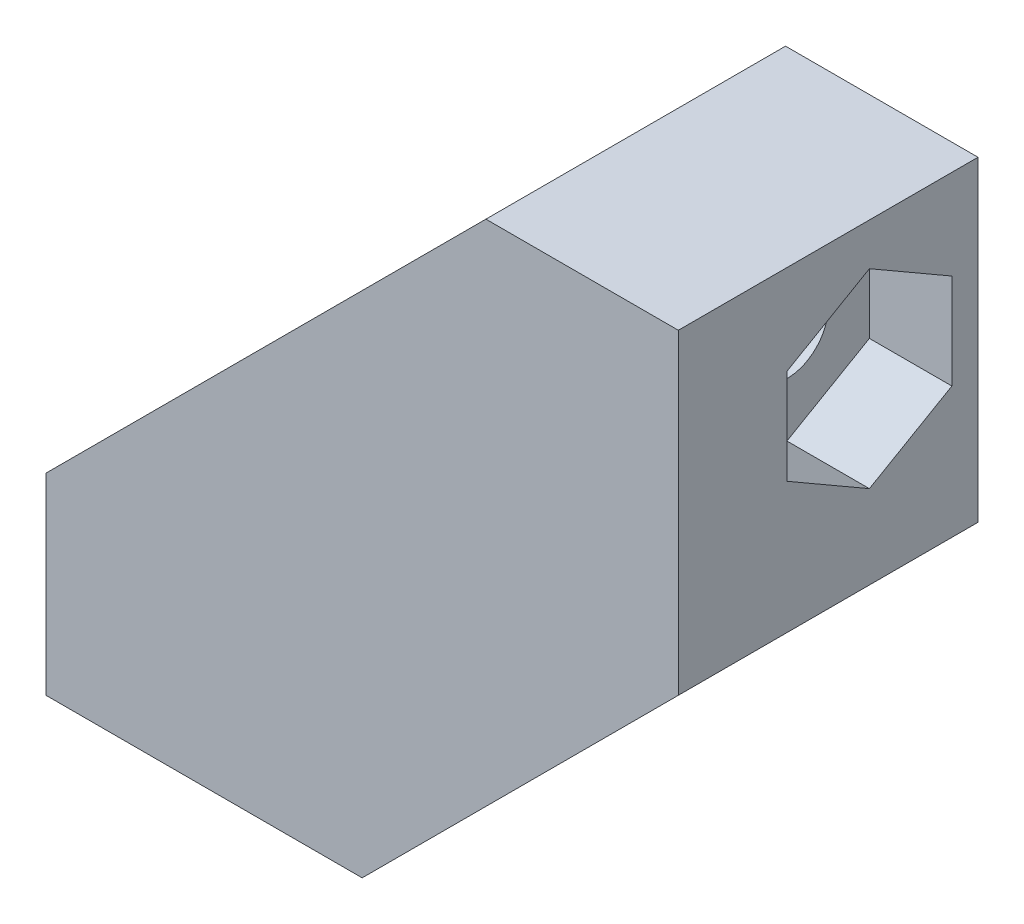
from build123d import *
from OCP.BRepFilletAPI import BRepFilletAPI_MakeChamfer

# Parameters (mm, degrees)
BOSS_EXTRUDE1_DEPTH = 7.9
SKETCH2_R           = 1.5
CUT_EXTRUDE1_DEPTH  = 52.15085532
CUT_EXTRUDE3_DEPTH  = 3
BOSS_EXTRUDE2_DEPTH = 3
SKETCH5_W           = 8.304797865
SKETCH5_H           = 8.5
CUT_EXTRUDE4_DEPTH  = 49.408780195
CHAMFER1_SIZE       = 2
CHAMFER1_SIZE2      = 3.079729928


with BuildPart() as part:
    # Sketch1 → Boss-Extrude1 (new body)
    with BuildSketch(Plane.XY):
        Polygon((30, 8), (30, 0), (22, 0), (22, -7), (33.5, -7), (45, 4.5), (45, 16), (38, 16), (38, 8), align=None)
    extrude(amount=-BOSS_EXTRUDE1_DEPTH)

    # Sketch2 → Cut-Extrude1 (cut, through all)
    with BuildSketch(Plane.XZ.offset(7)):
        with Locations((27, -3.95)):
            Circle(SKETCH2_R)
    cut_extrude1 = extrude(amount=-CUT_EXTRUDE1_DEPTH, mode=Mode.SUBTRACT)

    # Sketch3 → Cut-Extrude3 (cut)
    with BuildSketch(Plane(origin=(38, -7, 0), x_dir=(0, 0, -1), z_dir=(0, 1, 0))):
        Polygon((0.95, 12.732050808), (3.95, 14.464101615), (6.95, 12.732050808), (6.95, 9.267949192), (3.95, 7.535898385), (0.95, 9.267949192), align=None)
    cut_extrude3 = extrude(amount=CUT_EXTRUDE3_DEPTH, mode=Mode.SUBTRACT)

    # Sketch4 → Boss-Extrude2 (add)
    with BuildSketch(Plane.XY):
        Polygon((22, 0), (38, 16), (45, 16), (45, 4.5), (33.5, -7), (22, -7), align=None)
    extrude(amount=BOSS_EXTRUDE2_DEPTH)

    # Sketch5 → Cut-Extrude4 (cut, through all)
    with BuildSketch(Plane(origin=(0, 0, 0), x_dir=(1, 0, 0), z_dir=(0, 1, 0))):
        with Locations((26.152398932, 3.95)):
            Rectangle(SKETCH5_W, SKETCH5_H)
    cut_extrude4 = extrude(amount=CUT_EXTRUDE4_DEPTH, mode=Mode.SUBTRACT)

    # Mirror1: Cut-Extrude1, Cut-Extrude3, Cut-Extrude4 across plane
    add(cut_extrude1.mirror(Plane(origin=(19, 19, 0), x_dir=(0, 0, 1), z_dir=(0.707106781186547, 0.707106781186548, 0))), mode=Mode.SUBTRACT)
    add(cut_extrude3.mirror(Plane(origin=(19, 19, 0), x_dir=(0, 0, 1), z_dir=(0.707106781186547, 0.707106781186548, 0))), mode=Mode.SUBTRACT)
    add(cut_extrude4.mirror(Plane(origin=(19, 19, 0), x_dir=(0, 0, 1), z_dir=(0.707106781186547, 0.707106781186548, 0))), mode=Mode.SUBTRACT)

    # Chamfer1: one chamfer whose edges measure the first distance from different faces: ONE call of the kernel's chamfer builder (chamfer() names one face for all edges)
    chamfer1_edges_1 = [part.edges().sort_by_distance(p)[0] for p in [
        (34.152398932, 7.695202135, -7.9),
    ]]
    chamfer1_side_1 = [part.faces().sort_by_distance(p)[0] for p in [
        (34.152398932, 7.695202135, -3.8),
    ]]
    chamfer1_edges_2 = [part.edges().sort_by_distance(p)[0] for p in [
        (30.304797865, 3.847601068, -7.9),
    ]]
    chamfer1_side_2 = [part.faces().sort_by_distance(p)[0] for p in [
        (30.304797865, 3.847601068, -3.8),
    ]]
    chamfer1 = BRepFilletAPI_MakeChamfer(part.part.solid().wrapped)
    for e in chamfer1_edges_1:
        chamfer1.Add(CHAMFER1_SIZE, CHAMFER1_SIZE2, e.wrapped, chamfer1_side_1[0].wrapped)  # the first distance lies on this face
    for e in chamfer1_edges_2:
        chamfer1.Add(CHAMFER1_SIZE, CHAMFER1_SIZE2, e.wrapped, chamfer1_side_2[0].wrapped)  # the first distance lies on this face
    add(Compound.cast(chamfer1.Shape()), mode=Mode.REPLACE)


solid = part.part
